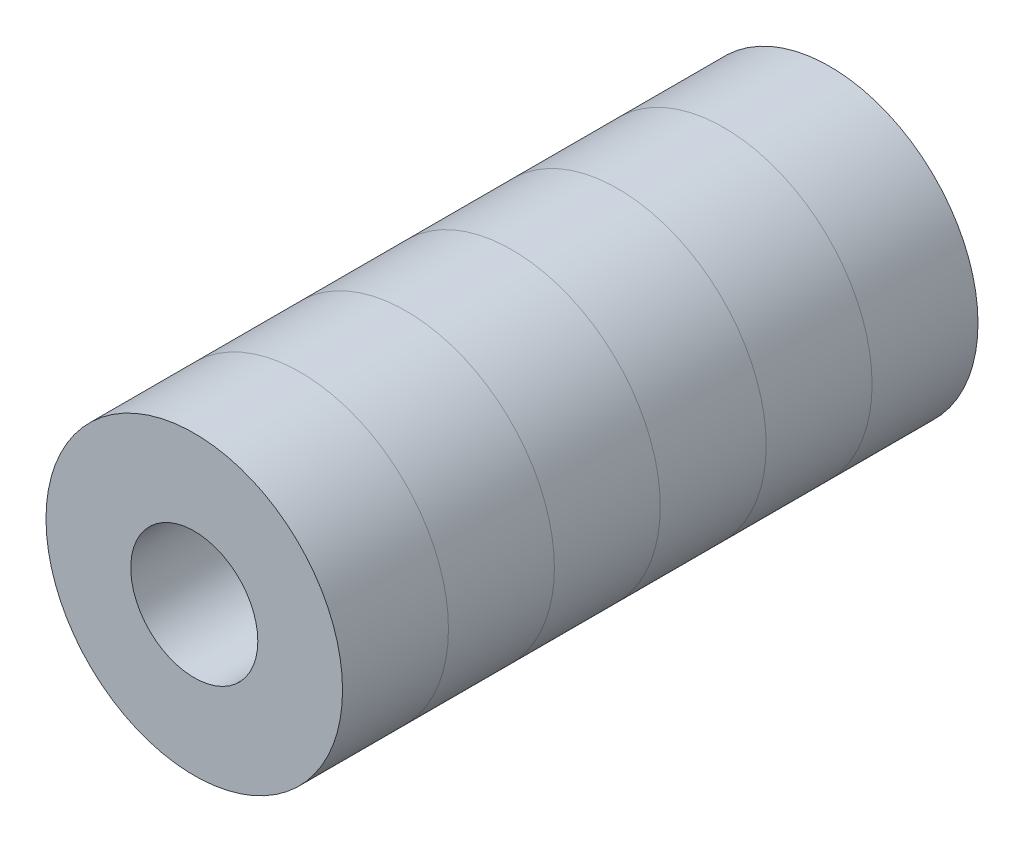
from build123d import *

# Parameters (mm, degrees)
SKETCH_1_R             = 3.5
SKETCH_1_R_2           = 1.5
EXTRUDE_1_DEPTH        = 2.5
PATTERN_LINEAR_1_COUNT = 6
PATTERN_LINEAR_1_PITCH = 2.5


with BuildPart() as part:
    # 草图1 → 凸台-拉伸1 (new body)
    with BuildSketch(Plane.XY):
        Circle(SKETCH_1_R)
        Circle(SKETCH_1_R_2, mode=Mode.SUBTRACT)
    extrude(amount=EXTRUDE_1_DEPTH)


with BuildPart() as pattern_linear_1_1:
    # 阵列(线性)1: pattern copy
    add(part.part.moved(Location(Vector(0, 0, -1) * (1 * PATTERN_LINEAR_1_PITCH))))


with BuildPart() as pattern_linear_1_2:
    # 阵列(线性)1: pattern copy
    add(part.part.moved(Location(Vector(0, 0, -1) * (2 * PATTERN_LINEAR_1_PITCH))))


with BuildPart() as pattern_linear_1_3:
    # 阵列(线性)1: pattern copy
    add(part.part.moved(Location(Vector(0, 0, -1) * (3 * PATTERN_LINEAR_1_PITCH))))


with BuildPart() as pattern_linear_1_4:
    # 阵列(线性)1: pattern copy
    add(part.part.moved(Location(Vector(0, 0, -1) * (4 * PATTERN_LINEAR_1_PITCH))))


with BuildPart() as pattern_linear_1_5:
    # 阵列(线性)1: pattern copy
    add(part.part.moved(Location(Vector(0, 0, -1) * (5 * PATTERN_LINEAR_1_PITCH))))


solid = Compound([part.part, pattern_linear_1_1.part, pattern_linear_1_2.part, pattern_linear_1_3.part, pattern_linear_1_4.part, pattern_linear_1_5.part])
